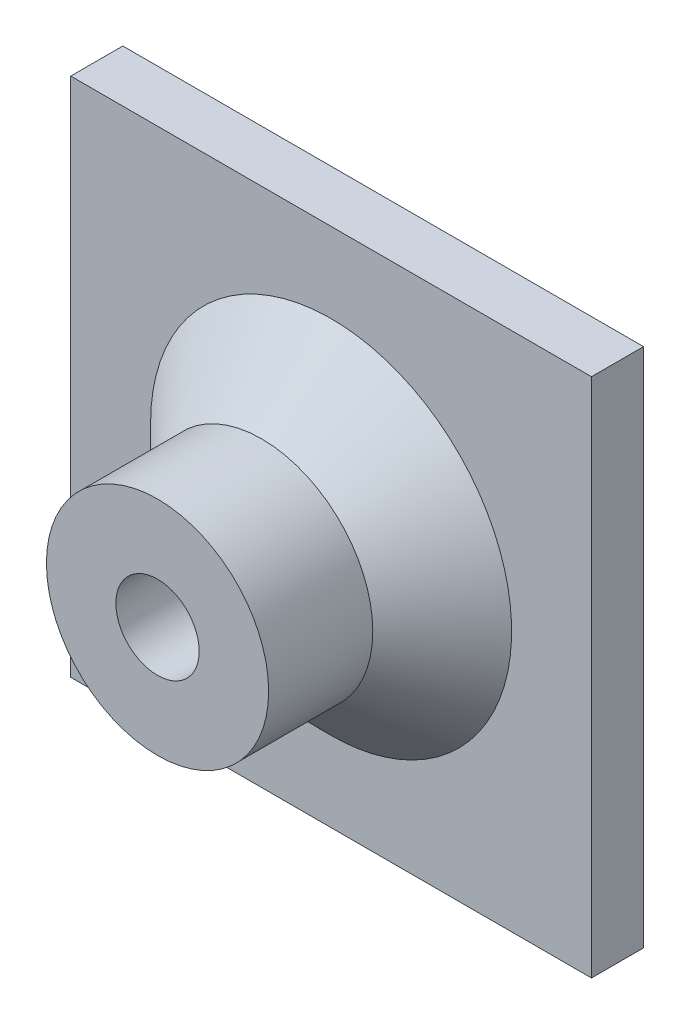
from build123d import *

# Parameters (mm, degrees)
SKETCH_2_W        = 15
SKETCH_2_H        = 15
SKETCH_2_R        = 1.2
EXTRUDE_430_DEPTH = 1.5
SKETCH_3_R        = 3.2
SKETCH_3_R_2      = 1.2
EXTRUDE_671_DEPTH = 5
CHAMFER_1_SIZE    = 1.2
CHAMFER_2_SIZE    = 2


with BuildPart() as part:
    # Эскиз2 → Extrude 430 (new body)
    with BuildSketch(Plane.XY):
        Rectangle(SKETCH_2_W, SKETCH_2_H)
        Circle(SKETCH_2_R, mode=Mode.SUBTRACT)
    extrude(amount=EXTRUDE_430_DEPTH)

    # Эскиз3 → Extrude 671 (add)
    with BuildSketch(Plane.XY.offset(1.5)):
        with Locations(Location((0, 0, 0), (0, 0, 180))):
            Circle(SKETCH_3_R)
        Circle(SKETCH_3_R_2, mode=Mode.SUBTRACT)
    extrude(amount=EXTRUDE_671_DEPTH)

    # Фаска1
    chamfer_1_edges = [part.edges().sort_by_distance(p)[0] for p in [
        (-1.2, 0, 0),
    ]]
    chamfer(chamfer_1_edges, length=CHAMFER_1_SIZE)

    # Фаска2
    chamfer_2_edges = [part.edges().sort_by_distance(p)[0] for p in [
        (3.2, 0, 1.5),
    ]]
    chamfer(chamfer_2_edges, length=CHAMFER_2_SIZE)


solid = part.part
